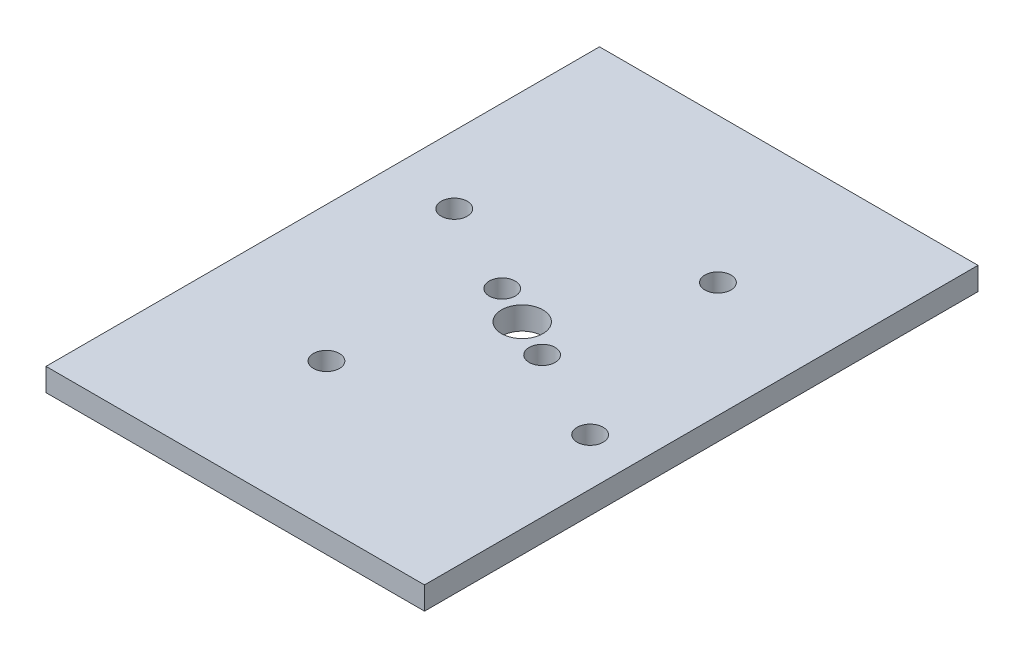
from build123d import *

# Parameters (mm, degrees)
SKETCH_1_W          = 58.128760995
SKETCH_1_H          = 85
SKETCH_1_R          = 3.175
EXTRUDE_1_DEPTH     = 3.5
SKETCH_2_R          = 2
CUT_EXTRUDE_1_DEPTH = 53.503533215


with BuildPart() as part:
    # Эскиз1 → Вытянуть1 (new body)
    with BuildSketch(Plane(origin=(0, 0, 0), x_dir=(1, 0, 0), z_dir=(0, 1, 0))):
        with Locations((-1.564380498, 0)):
            Rectangle(SKETCH_1_W, SKETCH_1_H)
        with Locations(Location((0, 0, 0), (0, 0, 270))):
            Circle(SKETCH_1_R, mode=Mode.SUBTRACT)
    extrude(amount=EXTRUDE_1_DEPTH)

    # Эскиз2 → Вырез-Вытянуть1 (cut, through all)
    with BuildSketch(Plane(origin=(0, 3.5, 0), x_dir=(1, 0, 0), z_dir=(0, 1, 0))):
        with Locations(Location((-5.945819696, 2.881931911, 0), (0, 0, 270))):
            Circle(SKETCH_2_R)
        with Locations(Location((5.945819696, -2.881931911, 0), (0, 0, 270))):
            Circle(SKETCH_2_R)
        with Locations(Location((20.247006678, -9.813700656, 0), (0, 0, 270))):
            Circle(SKETCH_2_R)
        with Locations(Location((9.813700656, 20.247006678, 0), (0, 0, 270))):
            Circle(SKETCH_2_R)
        with Locations(Location((-9.813700656, -20.247006678, 0), (0, 0, 270))):
            Circle(SKETCH_2_R)
        with Locations(Location((-20.247006678, 9.813700656, 0), (0, 0, 270))):
            Circle(SKETCH_2_R)
    extrude(amount=-CUT_EXTRUDE_1_DEPTH, mode=Mode.SUBTRACT)


solid = part.part
